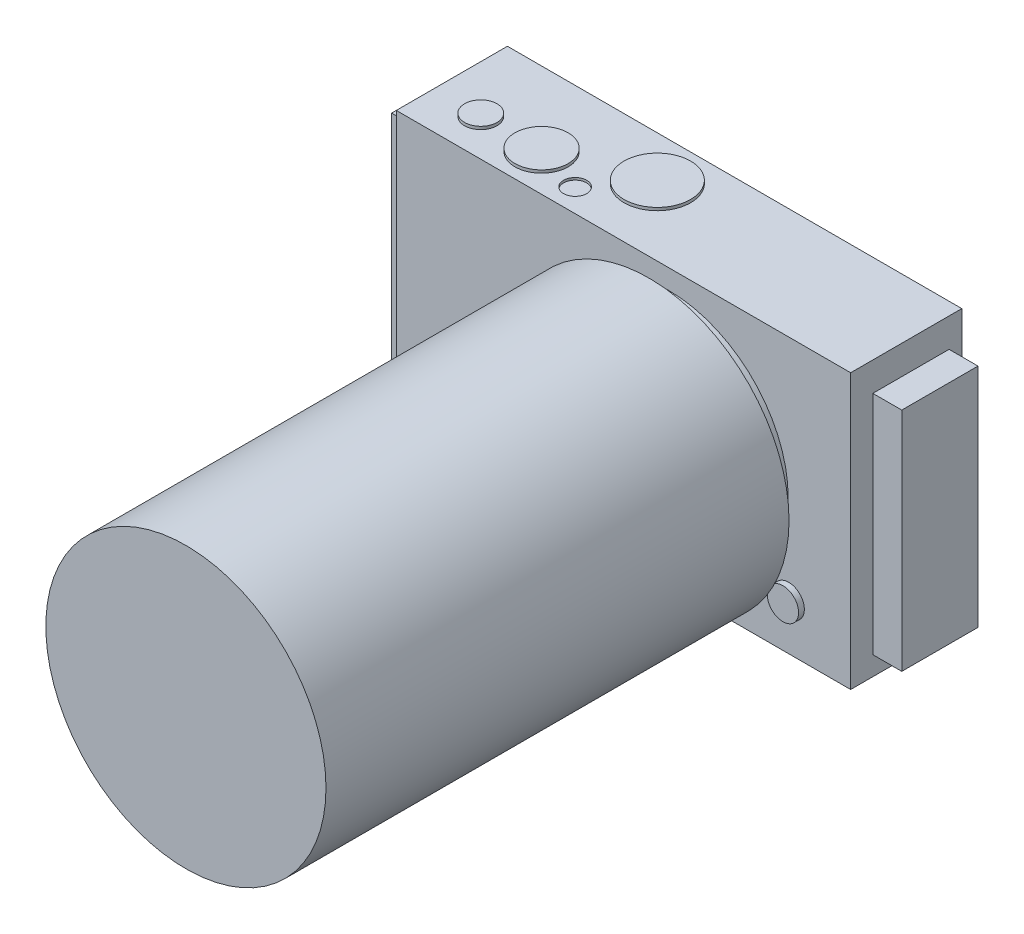
from build123d import *

# Parameters (mm, degrees)
SKETCH1_W           = 99.695
SKETCH1_H           = 60.198
BOSS_EXTRUDE1_DEPTH = 24.384
SKETCH2_R           = 26.2255
BOSS_EXTRUDE2_DEPTH = 4.318
SKETCH3_R           = 3.429
BOSS_EXTRUDE3_DEPTH = 1.27
SKETCH4_R           = 3.556
SKETCH4_R_2         = 5.842
SKETCH4_R_3         = 7.3025
BOSS_EXTRUDE4_DEPTH = 0.635
SKETCH7_R           = 2.54
CUT_EXTRUDE1_DEPTH  = 0.508
SKETCH8_R           = 3.175
CUT_EXTRUDE2_DEPTH  = 6.604
SKETCH9_W           = 10.16
SKETCH9_H           = 51.816
BOSS_EXTRUDE5_DEPTH = 6.35
SKETCH10_W          = 16.726375359
SKETCH10_H          = 49.657
BOSS_EXTRUDE6_DEPTH = 6.35
SKETCH11_R          = 30.734
BOSS_EXTRUDE7_DEPTH = 101.6


with BuildPart() as part:
    # Sketch1 → Boss-Extrude1 (new body)
    with BuildSketch(Plane.XY):
        with Locations((49.8475, 30.099)):
            Rectangle(SKETCH1_W, SKETCH1_H)
    extrude(amount=BOSS_EXTRUDE1_DEPTH)

    # Sketch2 → Boss-Extrude2 (add)
    with BuildSketch(Plane.XY.offset(24.384)):
        with Locations(Location((59.758770255, 29.6545, 0), (0, 0, 180))):
            Circle(SKETCH2_R)
    extrude(amount=BOSS_EXTRUDE2_DEPTH)

    # Sketch3 → Boss-Extrude3 (add)
    with BuildSketch(Plane.XY.offset(24.384)):
        with Locations(Location((86.106, 10.16, 0), (0, 0, 180))):
            Circle(SKETCH3_R)
    extrude(amount=BOSS_EXTRUDE3_DEPTH)

    # Sketch4 → Boss-Extrude4 (add)
    with BuildSketch(Plane(origin=(0, 60.198, 0), x_dir=(1, 0, 0), z_dir=(0, 1, 0))):
        with Locations(Location((10.414, -16.256, 0), (0, 0, 90))):
            Circle(SKETCH4_R)
        with Locations(Location((23.749, -16.256, 0), (0, 0, 90))):
            Circle(SKETCH4_R_2)
        with Locations(Location((42.545, -9.652, 0), (0, 0, 90))):
            Circle(SKETCH4_R_3)
    extrude(amount=BOSS_EXTRUDE4_DEPTH)

    # Sketch7 → Cut-Extrude1 (cut)
    with BuildSketch(Plane(origin=(0, 60.198, 0), x_dir=(1, 0, 0), z_dir=(0, 1, 0))):
        with Locations(Location((34.163, -19.304, 0), (0, 0, 270))):
            Circle(SKETCH7_R)
    extrude(amount=-CUT_EXTRUDE1_DEPTH, mode=Mode.SUBTRACT)

    # Sketch8 → Cut-Extrude2 (cut)
    with BuildSketch(Plane.XZ):
        with Locations(Location((60.325, 14.224, 0), (0, 0, 270))):
            Circle(SKETCH8_R)
    extrude(amount=-CUT_EXTRUDE2_DEPTH, mode=Mode.SUBTRACT)

    # Sketch9 → Boss-Extrude5 (add)
    with BuildSketch(Plane.ZY):
        with Locations((13.97, 27.94)):
            Rectangle(SKETCH9_W, SKETCH9_H)
    extrude(amount=BOSS_EXTRUDE5_DEPTH)

    # Sketch10 → Boss-Extrude6 (add)
    with BuildSketch(Plane(origin=(99.695, 0, 0), x_dir=(0, 0, -1), z_dir=(1, 0, 0))):
        with Locations((-11.15718768, 29.0195)):
            Rectangle(SKETCH10_W, SKETCH10_H)
    extrude(amount=BOSS_EXTRUDE6_DEPTH)

    # Sketch11 → Boss-Extrude7 (add)
    with BuildSketch(Plane.XY.offset(28.702)):
        with Locations((59.758770255, 29.6545)):
            Circle(SKETCH11_R)
    extrude(amount=BOSS_EXTRUDE7_DEPTH)


solid = part.part
